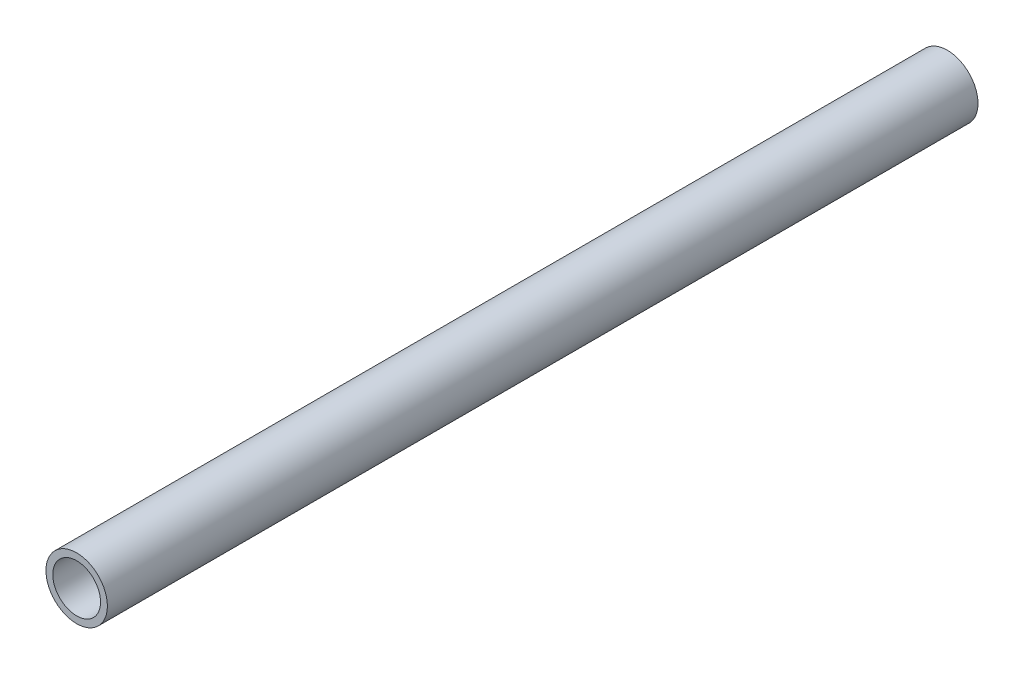
from build123d import *

# Parameters (mm, degrees)
SKETCH1_R           = 9
SKETCH1_R_2         = 7
BOSS_EXTRUDE1_DEPTH = 255.08


with BuildPart() as part:
    # Sketch1 → Boss-Extrude1 (new body)
    with BuildSketch(Plane.XY):
        Circle(SKETCH1_R)
        Circle(SKETCH1_R_2, mode=Mode.SUBTRACT)
    extrude(amount=BOSS_EXTRUDE1_DEPTH)


solid = part.part
